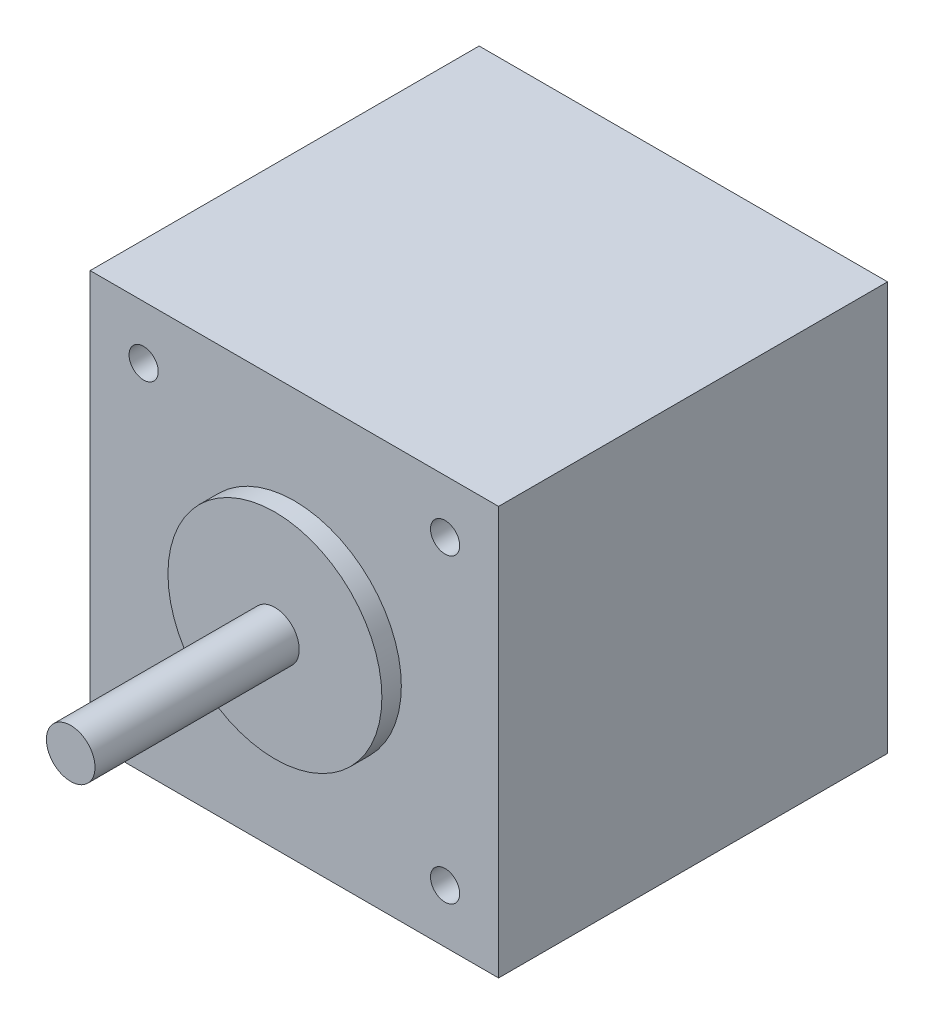
from build123d import *

# Parameters (mm, degrees)
SKETCH_1_W          = 42
SKETCH_1_H          = 42
EXTRUDE_1582_DEPTH  = 40
SKETCH_2_R          = 2.5
EXTRUDE_1637_DEPTH  = 63
SKETCH_3_R          = 11
EXTRUDE_1684_DEPTH  = 42
CUT_EXTRUDE_START   = 40
SKETCH_4_R          = 1.5
CUT_EXTRUDE_3_DEPTH = 4.5


with BuildPart() as part:
    # Эскиз1 → Extrude 1582 (new body)
    with BuildSketch(Plane.XY):
        Rectangle(SKETCH_1_W, SKETCH_1_H)
    extrude(amount=EXTRUDE_1582_DEPTH)

    # Эскиз2 → Extrude 1637 (add)
    with BuildSketch(Plane.XY):
        with Locations(Location((0, 0, 0), (0, 0, 180))):
            Circle(SKETCH_2_R)
    extrude(amount=EXTRUDE_1637_DEPTH)

    # Эскиз3 → Extrude 1684 (add)
    with BuildSketch(Plane.XY):
        with Locations(Location((0, 0, 0), (0, 0, 180))):
            Circle(SKETCH_3_R)
    extrude(amount=EXTRUDE_1684_DEPTH)

    # Эскиз4 → Крепеж_М3_ПРЕДВ (cut)
    with BuildSketch(Plane.XY.offset(CUT_EXTRUDE_START)):
        with Locations((-15.5, -15.5)):
            Circle(SKETCH_4_R)
        with Locations((-15.5, 15.5)):
            Circle(SKETCH_4_R)
        with Locations((15.5, -15.5)):
            Circle(SKETCH_4_R)
        with Locations((15.5, 15.5)):
            Circle(SKETCH_4_R)
    extrude(amount=-CUT_EXTRUDE_3_DEPTH, mode=Mode.SUBTRACT)


solid = part.part
